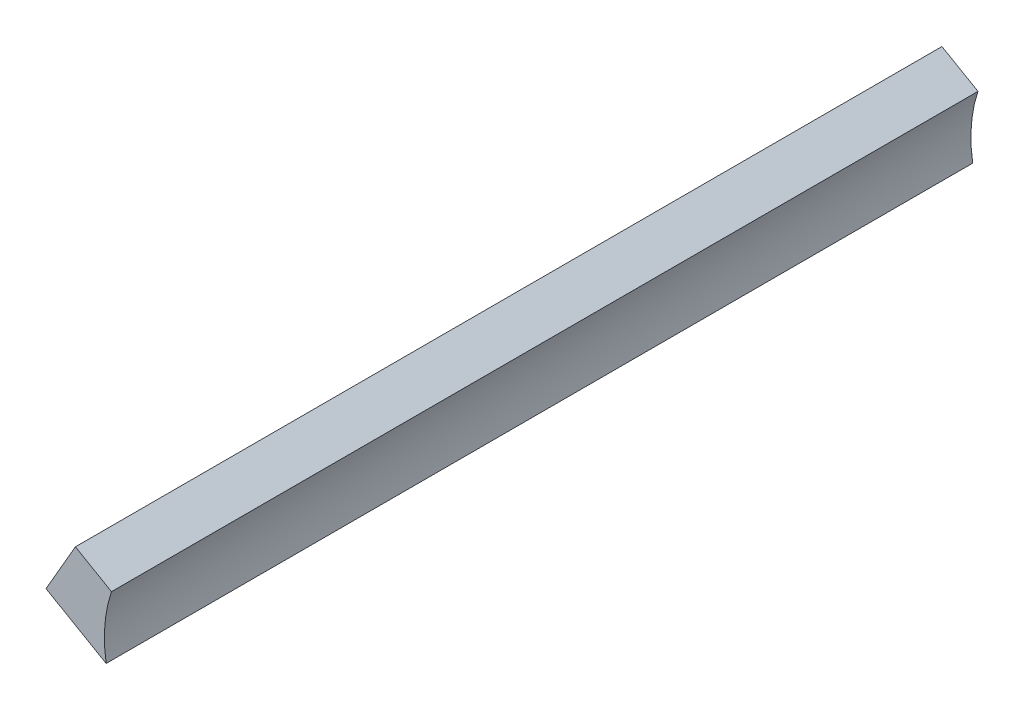
from build123d import *

# Parameters (mm, degrees)
BOSS_EXTRUDE1_DEPTH      = 25.4
BOSS_EXTRUDE1_DEPTH_BACK = 535.94
SKETCH2_R                = 6.35
CUT_EXTRUDE1_DEPTH       = 19


with BuildPart() as part:
    # Sketch1 → Boss-Extrude1 (new, two sides: drawn at the far end of the back side and taken through both)
    with BuildSketch(Plane.XY.offset(1031.10385267).offset(-BOSS_EXTRUDE1_DEPTH_BACK)):
        with BuildLine():
            Line((287.283668248, 598.671970668), (310.642299926, 585.186295534))
            ThreePointArc((310.642299926, 585.186295534), (306.336547982, 564.39371918), (307.203792995, 543.177720091))
            Line((307.203792995, 543.177720091), (268.233668248, 565.676402784))
            Line((268.233668248, 565.676402784), (287.283668248, 598.671970668))
        make_face()
    extrude(amount=BOSS_EXTRUDE1_DEPTH + BOSS_EXTRUDE1_DEPTH_BACK)

    # Sketch2 → Cut-Extrude1 (cut)
    with BuildSketch(Plane(origin=(-43.76981638, 25.270515269, 0), x_dir=(0, 0, 1), z_dir=(-0.8660254037844367, 0.5000000000000036, 0))):
        with Locations(Location((775.671183514, 643.215670872, 0), (0, 0, 270))):
            Circle(SKETCH2_R)
        with Locations(Location((929.595183514, 643.215670872, 0), (0, 0, 270))):
            Circle(SKETCH2_R)
        with Locations(Location((621.747183514, 643.215670872, 0), (0, 0, 270))):
            Circle(SKETCH2_R)
    extrude(amount=-CUT_EXTRUDE1_DEPTH, mode=Mode.SUBTRACT)


solid = part.part
